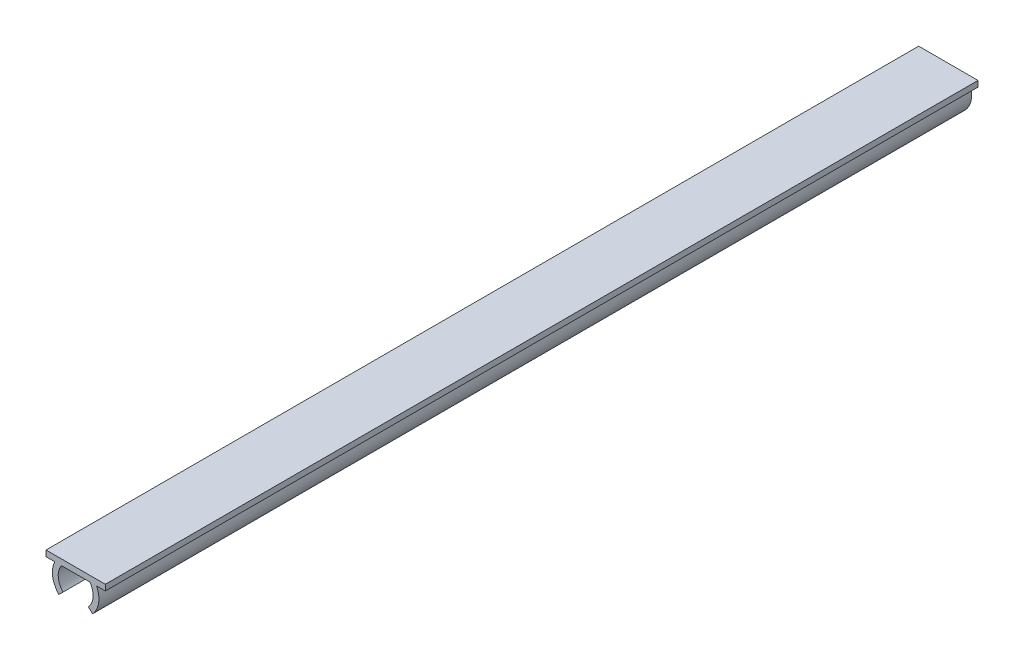
from build123d import *

# Parameters (mm, degrees)
EXTRUDE_1_DEPTH = 150


with BuildPart() as part:
    # 草图1 → 凸台-拉伸1 (new body)
    with BuildSketch(Plane.XY):
        with BuildLine():
            Line((-5.528570028, 2.461548542), (4.671429972, 2.461548542))
            Line((4.671429972, 2.461548542), (4.671429972, 1.461548542))
            Line((4.671429972, 1.461548542), (3.168303615, 1.461548542))
            ThreePointArc((3.168303615, 1.461548542), (3.524939412, -0.896532954), (2.476167482, -3.038451458))
            Line((2.476167482, -3.038451458), (1.749983104, -2.350951458))
            ThreePointArc((1.749983104, -2.350951458), (2.564576505, -0.491118257), (2.008128558, 1.461548542))
            Line((2.008128558, 1.461548542), (-2.865268614, 1.461548542))
            ThreePointArc((-2.865268614, 1.461548542), (-3.421716561, -0.491118257), (-2.60712316, -2.350951458))
            Line((-2.60712316, -2.350951458), (-3.333307538, -3.038451458))
            ThreePointArc((-3.333307538, -3.038451458), (-4.382079468, -0.896532954), (-4.02544367, 1.461548542))
            Line((-4.02544367, 1.461548542), (-5.528570028, 1.461548542))
            Line((-5.528570028, 1.461548542), (-5.528570028, 2.461548542))
        make_face()
    extrude(amount=EXTRUDE_1_DEPTH)


solid = part.part
